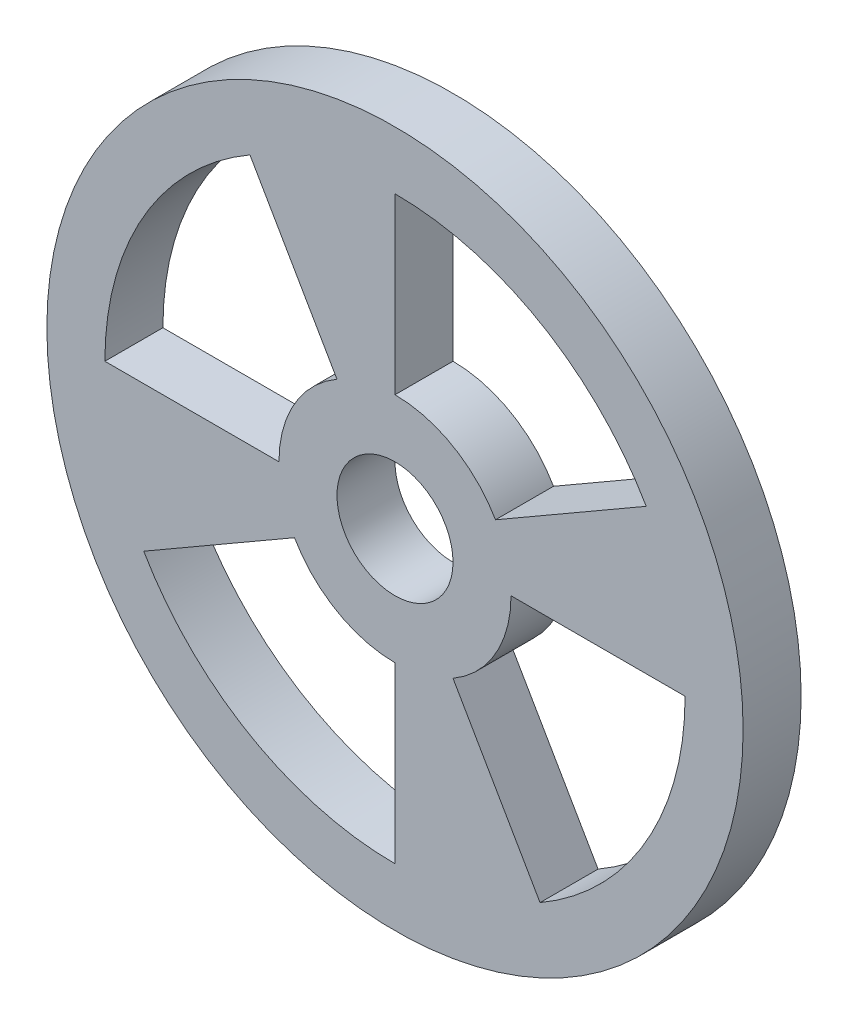
from build123d import *

# Parameters (mm, degrees)
SKETCH_1_R               = 60
SKETCH_1_R_2             = 10
EXTRUDE_1_DEPTH          = 10
CUT_EXTRUDE_1_DEPTH      = 121
PATTERN_CIRCULAR_1_COUNT = 4


with BuildPart() as part:
    # 草图1 → 凸台-拉伸1 (new body)
    with BuildSketch(Plane.XY):
        Circle(SKETCH_1_R)
        Circle(SKETCH_1_R_2, mode=Mode.SUBTRACT)
    extrude(amount=EXTRUDE_1_DEPTH)

    # 草图2 → 切除-拉伸1 (cut, symmetric)
    with BuildSketch(Plane.XY):
        with BuildLine():
            Line((0, 50), (0, 20))
            ThreePointArc((0, 20), (10, 17.320508076), (17.320508076, 10))
            Line((17.320508076, 10), (43.301270189, 25))
            ThreePointArc((43.301270189, 25), (25, 43.301270189), (0, 50))
        make_face()
    cut_extrude_1 = extrude(amount=CUT_EXTRUDE_1_DEPTH, both=True, mode=Mode.SUBTRACT)

    # 阵列(圆周)1: 切除-拉伸1 ×4 about axis
    pattern_circular_1_axis = Axis((0, 0, 10.5), (0, 0, -1))
    for i in range(1, PATTERN_CIRCULAR_1_COUNT):
        add(cut_extrude_1.rotate(pattern_circular_1_axis, i * 360 / PATTERN_CIRCULAR_1_COUNT), mode=Mode.SUBTRACT)


solid = part.part
